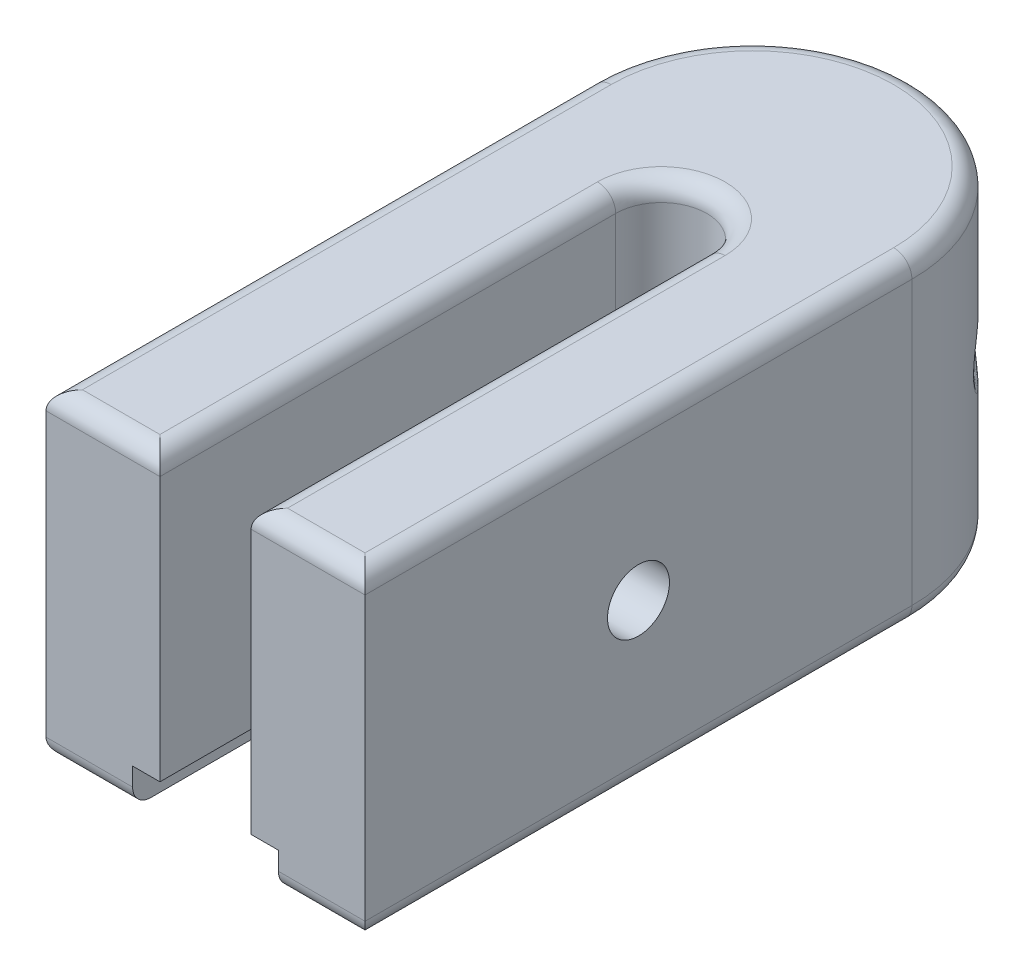
from build123d import *

# Parameters (mm, degrees)
SKETCH1_W                       = 22.225
SKETCH1_H                       = 22.225
BOSS_EXTRUDE1_DEPTH             = 38.1
BOSS_EXTRUDE3_REACH             = 43.214
BOSS_EXTRUDE3_DIRECTION_2_REACH = 43.214
SKETCH4_R                       = 2.159
CUT_EXTRUDE1_DEPTH              = 46.486792383
SKETCH8_R                       = 1.5875
CUT_EXTRUDE3_DEPTH              = 8.89
SKETCH7_R                       = 1.5875
CUT_EXTRUDE4_DEPTH              = 8.89
CUT_EXTRUDE6_DEPTH              = 46.486792456
FILLET1_R                       = 0.508
FILLET15_R                      = 1.27
BOSS_EXTRUDE15_DEPTH            = 2.54
SKETCH18_W                      = 10.16
SKETCH18_H                      = 6.120141002
CUT_EXTRUDE7_DEPTH              = 36.83


with BuildPart() as part:
    # Sketch1 → Boss-Extrude1 (new body)
    with BuildSketch(Plane.XY):
        Rectangle(SKETCH1_W, SKETCH1_H)
    extrude(amount=BOSS_EXTRUDE1_DEPTH)

    # Boss-Extrude3: up to this face of the body (flat: up to its plane)
    boss_extrude3_end = Plane(part.part.faces().sort_by_distance((0, 11.1125, 19.05))[0])
    # Sketch3 → Boss-Extrude3 (add, up to the picked face)
    with BuildSketch(Plane(origin=(0, 0, 0), x_dir=(1, 0, 0), z_dir=(0, 1, 0)), mode=Mode.PRIVATE) as boss_extrude3_sk1:
        with BuildLine():
            Line((-11.1125, 0), (11.1125, 0))
            ThreePointArc((11.1125, 0), (0, 11.1125), (-11.1125, 0))
        make_face()
    boss_extrude3_tool1 = split(extrude(boss_extrude3_sk1.sketch, amount=BOSS_EXTRUDE3_REACH, mode=Mode.PRIVATE), bisect_by=boss_extrude3_end, keep=Keep.BOTH, mode=Mode.PRIVATE)
    add(boss_extrude3_tool1.solids().sort_by(Axis((0, 0, -4.716291), (0, 1, 0)))[0])

    # Boss-Extrude3 direction 2: up to this face of the body (flat: up to its plane)
    boss_extrude3_direction_2_end = Plane(part.part.faces().sort_by_distance((0, -11.1125, 19.05))[0])
    # Sketch3 → Boss-Extrude3 direction 2 (add, up to the picked face)
    with BuildSketch(Plane(origin=(0, 0, 0), x_dir=(1, 0, 0), z_dir=(0, 1, 0)), mode=Mode.PRIVATE) as boss_extrude3_direction_2_sk1:
        with BuildLine():
            Line((-11.1125, 0), (11.1125, 0))
            ThreePointArc((11.1125, 0), (0, 11.1125), (-11.1125, 0))
        make_face()
    boss_extrude3_direction_2_tool1 = split(extrude(boss_extrude3_direction_2_sk1.sketch, amount=-BOSS_EXTRUDE3_DIRECTION_2_REACH, mode=Mode.PRIVATE), bisect_by=boss_extrude3_direction_2_end, keep=Keep.BOTH, mode=Mode.PRIVATE)
    add(boss_extrude3_direction_2_tool1.solids().sort_by(Axis((0, 0, -4.716291), (0, -1, 0)))[0])

    # Sketch4 → Cut-Extrude1 (cut, through all)
    with BuildSketch(Plane(origin=(11.1125, 0, 0), x_dir=(0, 0, -1), z_dir=(1, 0, 0))):
        with Locations((-19.05, 0)):
            Circle(SKETCH4_R)
    extrude(amount=-CUT_EXTRUDE1_DEPTH, mode=Mode.SUBTRACT)

    # Sketch8 → Cut-Extrude3 (cut)
    with BuildSketch(Plane(origin=(7.857724106, 0, -7.857724106), x_dir=(-0.7071067811865515, 0, -0.7071067811865436), z_dir=(0.7071067811865436, 0, -0.7071067811865515))):
        Circle(SKETCH8_R)
    extrude(amount=-CUT_EXTRUDE3_DEPTH, mode=Mode.SUBTRACT)

    # Sketch7 → Cut-Extrude4 (cut)
    with BuildSketch(Plane(origin=(-7.857724106, 0, -7.857724106), x_dir=(0.7071067811865512, 0, -0.7071067811865439), z_dir=(0.7071067811865439, 0, 0.7071067811865512))):
        with Locations(Location((0, 0, 0), (0, 0, 180))):
            Circle(SKETCH7_R)
    extrude(amount=CUT_EXTRUDE4_DEPTH, mode=Mode.SUBTRACT)

    # Sketch10 → Cut-Extrude6 (cut, through all)
    with BuildSketch(Plane(origin=(0, -11.1125, 0), x_dir=(-1, 0, 0), z_dir=(0, -1, 0))):
        with BuildLine():
            Line((3.175, -6.35), (3.175, -44.45))
            ThreePointArc((3.175, -44.45), (0, -47.625), (-3.175, -44.45))
            Line((-3.175, -44.45), (-3.175, -6.35))
            ThreePointArc((-3.175, -6.35), (0, -3.175), (3.175, -6.35))
        make_face()
    extrude(amount=-CUT_EXTRUDE6_DEPTH, mode=Mode.SUBTRACT)

    # Fillet1
    fillet1_edges = [part.edges().sort_by_distance(p)[0] for p in [
        (8.89966195, 5e-09, -6.654597918),
        (-6.654597918, -5e-09, -8.89966195),
    ]]
    fillet(fillet1_edges, radius=FILLET1_R)

    # Fillet15
    fillet15_edges = [part.edges().sort_by_distance(p)[0] for p in [
        (-7.14375, -11.1125, 38.1),
        (0, 11.1125, -11.1125),
        (0, -11.1125, -11.1125),
        (-7.14375, 11.1125, 38.1),
        (7.14375, -11.1125, 38.1),
        (-3.175, 11.1125, 22.225),
        (3.175, 11.1125, 22.225),
        (0, 11.1125, 3.175),
        (-3.175, -11.1125, 22.225),
        (0, -11.1125, 3.175),
        (3.175, -11.1125, 22.225),
        (7.14375, 11.1125, 38.1),
        (11.1125, -11.1125, 19.05),
        (-11.1125, -11.1125, 19.05),
        (-11.1125, 11.1125, 19.05),
        (11.1125, 11.1125, 19.05),
    ]]
    fillet(fillet15_edges, radius=FILLET15_R)

    # Sketch14 → Boss-Extrude15 (add, symmetric)
    with BuildSketch(Plane(origin=(0, 0, 0), x_dir=(1, 0, 0), z_dir=(0, 1, 0))):
        Polygon((0.332639056, 2.225283), (-2.103732557, -0.211088613), (0.082871249, -2.397692418), (2.519242862, 0.038679195), align=None)
    extrude(amount=BOSS_EXTRUDE15_DEPTH, both=True)

    # Sketch18 → Cut-Extrude7 (cut)
    with BuildSketch(Plane.XY.offset(38.1)):
        with Locations((0, -11.632570501)):
            Rectangle(SKETCH18_W, SKETCH18_H)
    extrude(amount=-CUT_EXTRUDE7_DEPTH, mode=Mode.SUBTRACT)


solid = part.part
